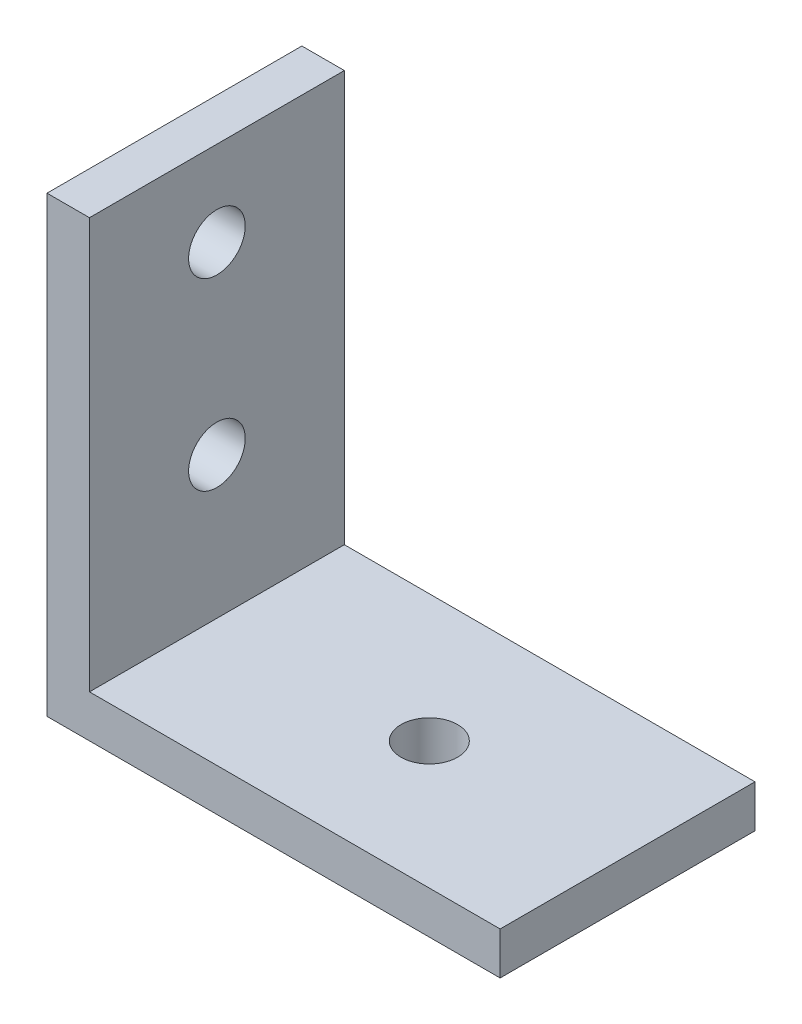
from build123d import *

# Parameters (mm, degrees)
SKETCH1_W           = 32
SKETCH1_H           = 18
BOSS_EXTRUDE1_DEPTH = 3
SKETCH2_W           = 3
SKETCH2_H           = 18
BOSS_EXTRUDE2_DEPTH = 29
SKETCH3_R           = 2
CUT_EXTRUDE1_DEPTH  = 47.786750261
SKETCH4_R           = 2
CUT_EXTRUDE2_DEPTH  = 47.786750261


with BuildPart() as part:
    # Sketch1 → Boss-Extrude1 (new body)
    with BuildSketch(Plane(origin=(0, 0, 0), x_dir=(1, 0, 0), z_dir=(0, 1, 0))):
        with Locations((16, 9)):
            Rectangle(SKETCH1_W, SKETCH1_H)
    extrude(amount=BOSS_EXTRUDE1_DEPTH)

    # Sketch2 → Boss-Extrude2 (add)
    with BuildSketch(Plane(origin=(0, 3, 0), x_dir=(1, 0, 0), z_dir=(0, 1, 0))):
        with Locations((1.5, 9)):
            Rectangle(SKETCH2_W, SKETCH2_H)
    extrude(amount=BOSS_EXTRUDE2_DEPTH)

    # Sketch3 → Cut-Extrude1 (cut, through all)
    with BuildSketch(Plane(origin=(0, 3, 0), x_dir=(1, 0, 0), z_dir=(0, 1, 0))):
        with Locations(Location((18, 9, 0), (0, 0, 270))):
            Circle(SKETCH3_R)
    extrude(amount=-CUT_EXTRUDE1_DEPTH, mode=Mode.SUBTRACT)

    # Sketch4 → Cut-Extrude2 (cut, through all)
    with BuildSketch(Plane(origin=(3, 0, 0), x_dir=(0, 0, -1), z_dir=(1, 0, 0))):
        with Locations((9, 26)):
            Circle(SKETCH4_R)
        with Locations((9, 13)):
            Circle(SKETCH4_R)
    extrude(amount=-CUT_EXTRUDE2_DEPTH, mode=Mode.SUBTRACT)


solid = part.part
